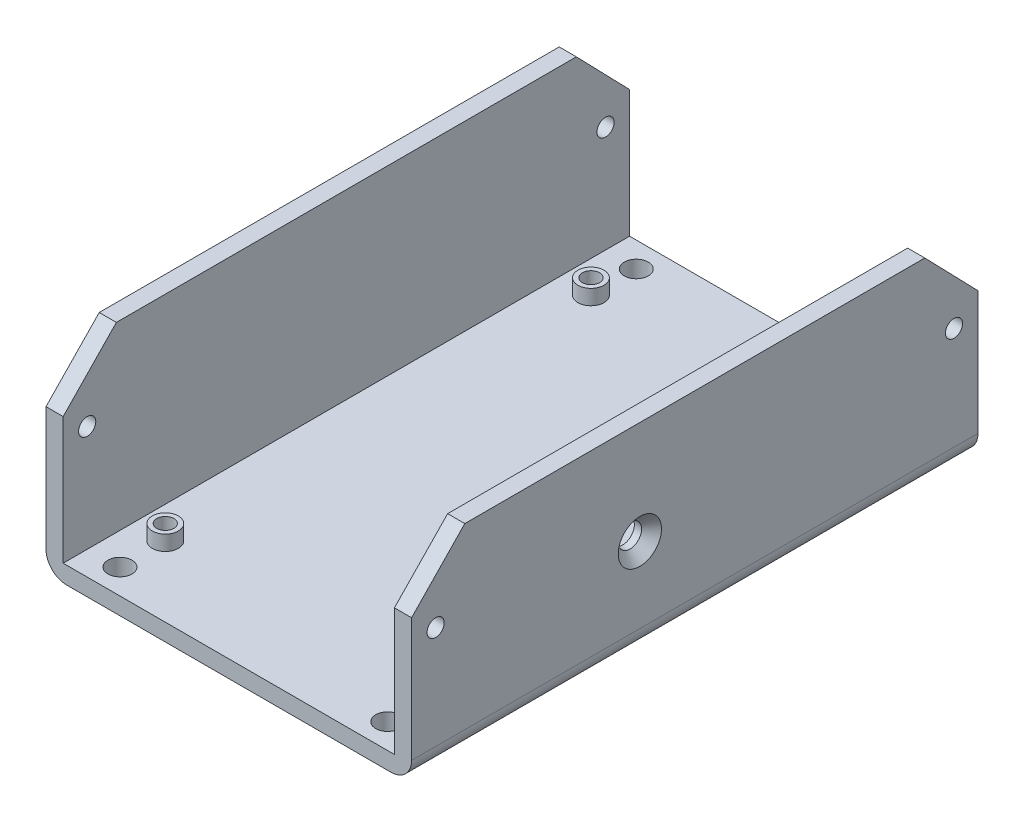
from build123d import *

# Parameters (mm, degrees)
EXTRUDE_1_DEPTH               = 41.25
CUT_EXTRUDE_1_DEPTH           = 58.02151458
CUT_EXTRUDE_1_DEPTH_BACK      = 58.02151458
SKETCH_4_R                    = 1.75
CUT_EXTRUDE_2_DEPTH           = 10
HOLE_WIZARD_M31_REACH         = 75.336
HOLE_WIZARD_M31_BORE_R        = 1.25
HOLE_WIZARD_M32_D             = 2.5
SKETCH_10_R                   = 1.9
EXTRUDE_2_DEPTH               = 2.2
HOLE_WIZARD_M33_D             = 2.5
HOLE_WIZARD_M31_2_D           = 3.4
HOLE_WIZARD_M31_2_DEPTH       = 8.5
HOLE_WIZARD_M31_2_CSINK_D     = 6.3
HOLE_WIZARD_M31_2_CSINK_ANGLE = 90
HOLE_WIZARD_M31_2_TIP         = 1.021463052


with BuildPart() as part:
    # Эскиз1 → Бобышка-Вытянуть1 (new, symmetric)
    with BuildSketch(Plane.XY):
        with BuildLine():
            Line((-26.625, 29), (-26.625, 3))
            ThreePointArc((-26.625, 3), (-25.746320344, 0.878679656), (-23.625, 0))
            Line((-23.625, 0), (23.625, 0))
            ThreePointArc((23.625, 0), (25.746320344, 0.878679656), (26.625, 3))
            Line((26.625, 3), (26.625, 29))
            Line((26.625, 29), (24.125, 29))
            Line((24.125, 29), (24.125, 2.5))
            Line((24.125, 2.5), (-24.125, 2.5))
            Line((-24.125, 2.5), (-24.125, 29))
            Line((-24.125, 29), (-26.625, 29))
        make_face()
    extrude(amount=EXTRUDE_1_DEPTH, both=True)

    # Эскиз3 → Вырез-Вытянуть1 (cut, two sides: drawn at the far end of the back side and taken through both)
    with BuildSketch(Plane(origin=(0, 0, 0), x_dir=(0, 0, -1), z_dir=(1, 0, 0)).offset(-CUT_EXTRUDE_1_DEPTH_BACK)):
        Polygon((41.25, 21), (41.25, 29), (33.5, 29), align=None)
        Polygon((-41.25, 21), (-41.25, 29), (-33.5, 29), align=None)
    extrude(amount=CUT_EXTRUDE_1_DEPTH + CUT_EXTRUDE_1_DEPTH_BACK, mode=Mode.SUBTRACT)

    # Эскиз4 → Вырез-Вытянуть2 (cut)
    with BuildSketch(Plane.XZ):
        with Locations((-19.5, -37.6)):
            Circle(SKETCH_4_R)
        with Locations((-19.5, 37.6)):
            Circle(SKETCH_4_R)
        with Locations((19.5, 37.6)):
            Circle(SKETCH_4_R)
        with Locations((19.5, -37.6)):
            Circle(SKETCH_4_R)
    extrude(amount=-CUT_EXTRUDE_2_DEPTH, mode=Mode.SUBTRACT)

    # Hole Wizard M31 bore → Hole Wizard M31 (cut, up to next)
    with BuildSketch(Plane(origin=(26.625, 0, 0), x_dir=(0, 0, -1), z_dir=(1, 0, 0)), mode=Mode.PRIVATE) as hole_wizard_m31_sk1:
        with Locations((37.75, 18)):
            Circle(HOLE_WIZARD_M31_BORE_R)
    hole_wizard_m31_tool1 = extrude(hole_wizard_m31_sk1.sketch, amount=-HOLE_WIZARD_M31_REACH, mode=Mode.PRIVATE) & part.part
    # Hole Wizard M31 bore → Hole Wizard M31 (cut, up to next)
    with BuildSketch(Plane(origin=(26.625, 0, 0), x_dir=(0, 0, -1), z_dir=(1, 0, 0)), mode=Mode.PRIVATE) as hole_wizard_m31_sk2:
        with Locations((-37.75, 18)):
            Circle(HOLE_WIZARD_M31_BORE_R)
    hole_wizard_m31_tool2 = extrude(hole_wizard_m31_sk2.sketch, amount=-HOLE_WIZARD_M31_REACH, mode=Mode.PRIVATE) & part.part
    add(hole_wizard_m31_tool1.solids().sort_by_distance((26.625, 18, -37.75))[0], mode=Mode.SUBTRACT)
    add(hole_wizard_m31_tool2.solids().sort_by_distance((26.625, 18, 37.75))[0], mode=Mode.SUBTRACT)

    # Отверстие обработанное метчиком M32 (through all)
    with Locations(Plane.ZY.offset(26.625)):
        with Locations((-37.75, 18), (37.75, 18)):
            Hole(HOLE_WIZARD_M32_D / 2)

    # Эскиз10 → Бобышка-Вытянуть2 (add)
    with BuildSketch(Plane(origin=(0, 2.5, 0), x_dir=(1, 0, 0), z_dir=(0, 1, 0))):
        with Locations(Location((19.5, 31, 0), (0, 0, 90))):
            Circle(SKETCH_10_R)
        with Locations(Location((19.5, -31, 0), (0, 0, 90))):
            Circle(SKETCH_10_R)
        with Locations(Location((-19.5, -31, 0), (0, 0, 90))):
            Circle(SKETCH_10_R)
        with Locations(Location((-19.5, 31, 0), (0, 0, 90))):
            Circle(SKETCH_10_R)
    extrude(amount=EXTRUDE_2_DEPTH)

    # Отверстие обработанное метчиком M33 (through all)
    with Locations(Plane(origin=(0, 4.7, 0), x_dir=(1, 0, 0), z_dir=(0, 1, 0))):
        with Locations((19.5, 31), (-19.5, 31), (19.5, -31), (-19.5, -31)):
            Hole(HOLE_WIZARD_M33_D / 2)

    # Hole Wizard M31 2
    with Locations(Plane(origin=(26.625, 0, 0), x_dir=(0, 0, -1), z_dir=(1, 0, 0))):
        with Locations((-8, 14)):
            CounterSinkHole(HOLE_WIZARD_M31_2_D / 2, HOLE_WIZARD_M31_2_CSINK_D / 2, depth=HOLE_WIZARD_M31_2_DEPTH, counter_sink_angle=HOLE_WIZARD_M31_2_CSINK_ANGLE)
            with Locations((0, 0, -(HOLE_WIZARD_M31_2_DEPTH + HOLE_WIZARD_M31_2_TIP / 2))):  # 118° drill point
                Cone(0, HOLE_WIZARD_M31_2_D / 2, HOLE_WIZARD_M31_2_TIP, mode=Mode.SUBTRACT)


solid = part.part
